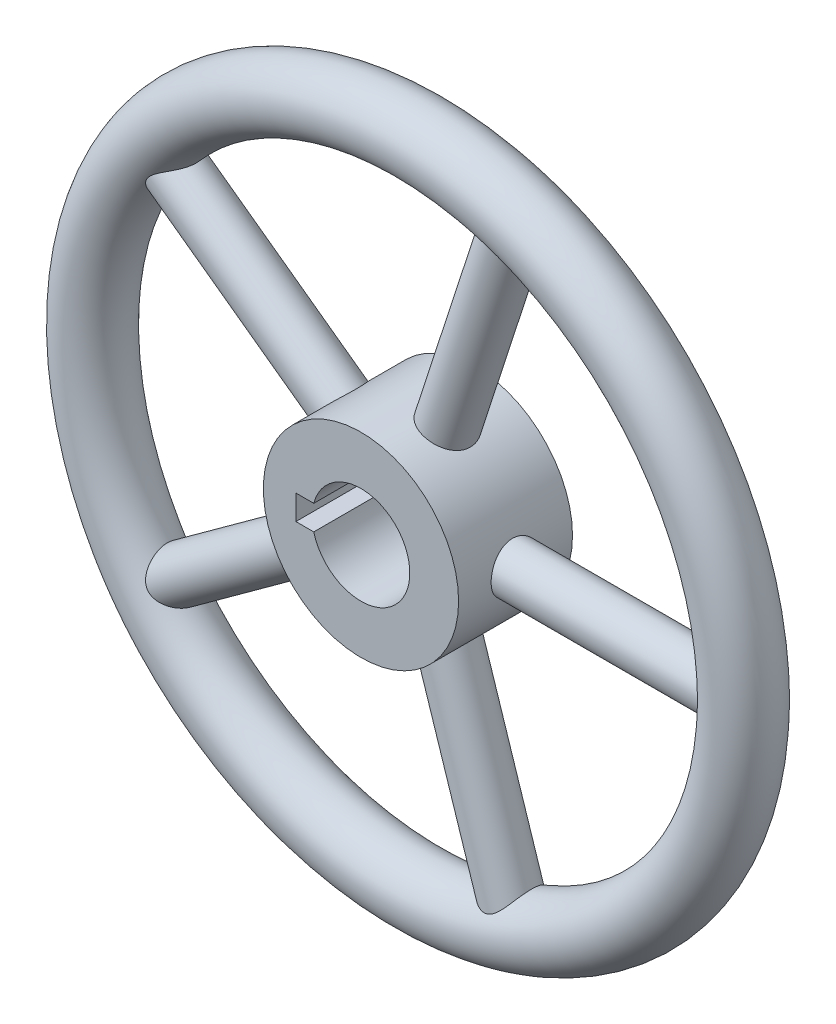
from build123d import *
from build123d.topology import SkipClean

# Parameters (mm, degrees)
CROQUIS2_R              = 38.1
SALIENTE_EXTRUIR1_DEPTH = 44.45
CROQUIS4_R              = 9.525
SALIENTE_EXTRUIR3_DEPTH = 127
MATRIZC2_COUNT          = 5
CROQUIS8_R              = 12.7
CORTAR_EXTRUIR1_DEPTH   = 203.504277893


with BuildPart() as part:
    # Croquis2 → Saliente-Extruir1 (new body)
    with BuildSketch(Plane.XY):
        Circle(CROQUIS2_R)
    extrude(amount=SALIENTE_EXTRUIR1_DEPTH)

    # Croquis4 → Saliente-Extruir3 (add)
    with BuildSketch(Plane(origin=(0, 0, 0), x_dir=(0, 0, -1), z_dir=(1, 0, 0))):
        with Locations((-22.225, 0)):
            Circle(CROQUIS4_R)
    saliente_extruir3 = extrude(amount=SALIENTE_EXTRUIR3_DEPTH)

    # MatrizC2: Saliente-Extruir3 ×5 about axis
    matrizc2_axis = Axis((0, 0, 44.45), (0, 0, -1))
    for i in range(1, MATRIZC2_COUNT):
        add(saliente_extruir3.rotate(matrizc2_axis, i * 360 / MATRIZC2_COUNT))

    # Croquis8 → Revolución1 (revolve)
    with SkipClean():  # the faces are left unmerged after this step: merging them gives an invalid solid
        with BuildSketch(Plane(origin=(0, 0, 0), x_dir=(0, 0, -1), z_dir=(1, 0, 0))):
            with Locations((-22.225, 127)):
                Circle(CROQUIS8_R)
        revolve(axis=Axis((0, 0, 44.45), (0, 0, -1)))

    # Croquis9 → Cortar-Extruir1 (cut, through all)
    with SkipClean():  # the faces are left unmerged after this step: merging them gives an invalid solid
        with BuildSketch(Plane.XY.offset(44.45)):
            with BuildLine():
                Line((-18.428570862, 4.826), (-25.4, 4.826))
                Line((-25.4, 4.826), (-25.4, -4.826))
                Line((-25.4, -4.826), (-18.428570862, -4.826))
                ThreePointArc((-18.428570862, -4.826), (19.05, 0), (-18.428570862, 4.826))
            make_face()
        extrude(amount=-CORTAR_EXTRUIR1_DEPTH, mode=Mode.SUBTRACT)


solid = part.part
